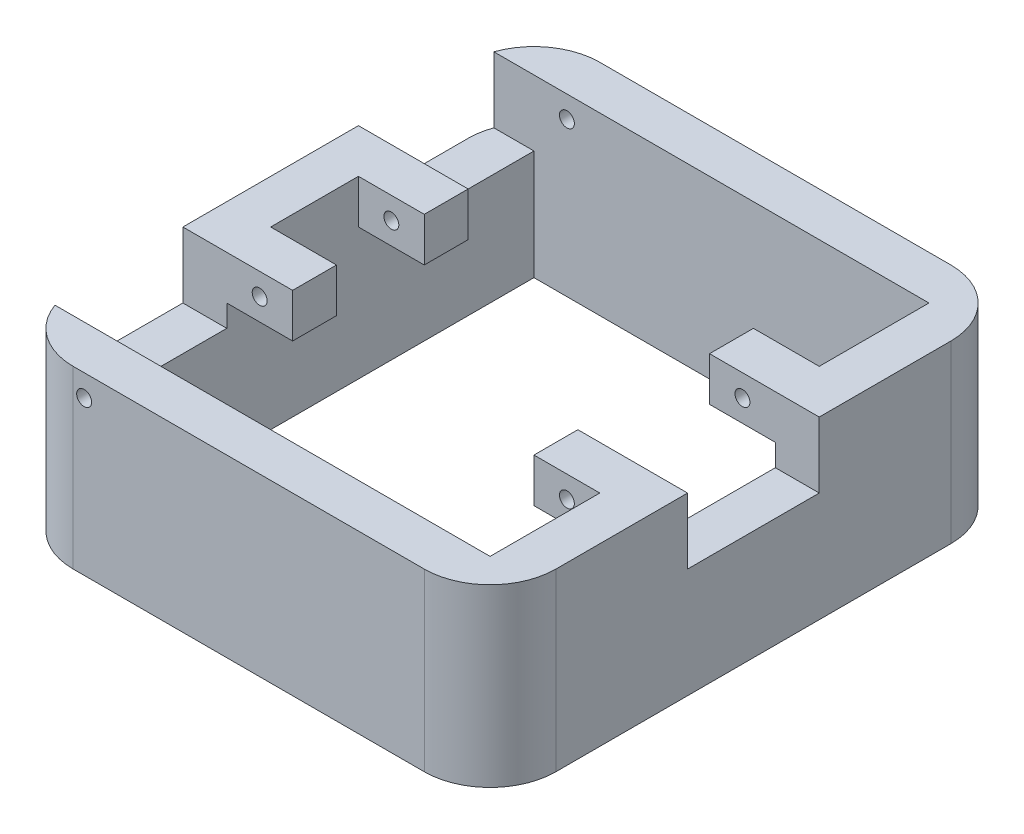
from build123d import *

# Parameters (mm, degrees)
SKETCH1_W               = 90
SKETCH1_H               = 100
BOSS_EXTRUDE1_DEPTH     = 40
SKETCH3_W               = 25
SKETCH3_H               = 40
BOSS_EXTRUDE3_DEPTH     = 10
SKETCH5_W               = 15
SKETCH5_H               = 20
CUT_EXTRUDE1_DEPTH      = 10
SKETCH6_W               = 25
SKETCH6_H               = 10
BOSS_EXTRUDE4_DEPTH     = 10
SKETCH7_W               = 10
SKETCH7_H               = 30
CUT_EXTRUDE2_DEPTH      = 15
CUT_EXTRUDE3_DEPTH      = 108.861822617
CUT_EXTRUDE3_DEPTH_BACK = 108.861822617
SKETCH8_R               = 1.7
SKETCH9_R               = 1.7
CUT_EXTRUDE4_DEPTH      = 57


with BuildPart() as part:
    # Sketch1 → Boss-Extrude1 (new body)
    with BuildSketch(Plane(origin=(0, 0, 0), x_dir=(1, 0, 0), z_dir=(0, 1, 0))):
        with BuildLine():
            Line((-45.284100543, 33.309612736), (34.715899457, 33.309612736))
            ThreePointArc((34.715899457, 33.309612736), (45.322501175, 28.916214454), (49.715899457, 18.309612736))
            Line((49.715899457, 18.309612736), (49.715899457, -71.690387264))
            ThreePointArc((49.715899457, -71.690387264), (45.322501175, -82.296988982), (34.715899457, -86.690387264))
            Line((34.715899457, -86.690387264), (-45.284100543, -86.690387264))
            ThreePointArc((-45.284100543, -86.690387264), (-55.890702261, -82.296988982), (-60.284100543, -71.690387264))
            Line((-60.284100543, -71.690387264), (-60.284100543, 18.309612736))
            ThreePointArc((-60.284100543, 18.309612736), (-55.890702261, 28.916214454), (-45.284100543, 33.309612736))
        make_face()
        with Locations((-5.284100543, -26.690387264)):
            Rectangle(SKETCH1_W, SKETCH1_H, mode=Mode.SUBTRACT)
    extrude(amount=BOSS_EXTRUDE1_DEPTH)

    # Sketch3 → Boss-Extrude3 (add)
    with BuildSketch(Plane(origin=(0, 40, 0), x_dir=(1, 0, 0), z_dir=(0, 1, 0))):
        with Locations((-47.784100543, -26.690387264)):
            Rectangle(SKETCH3_W, SKETCH3_H)
    extrude(amount=-BOSS_EXTRUDE3_DEPTH)

    # Sketch5 → Cut-Extrude1 (cut)
    with BuildSketch(Plane(origin=(0, 40, 0), x_dir=(1, 0, 0), z_dir=(0, 1, 0))):
        with Locations((-42.784100543, -26.690387264)):
            Rectangle(SKETCH5_W, SKETCH5_H)
    extrude(amount=-CUT_EXTRUDE1_DEPTH, mode=Mode.SUBTRACT)

    # Sketch6 → Boss-Extrude4 (add)
    with BuildSketch(Plane(origin=(0, 40, 0), x_dir=(1, 0, 0), z_dir=(0, 1, 0))):
        with Locations((37.215899457, -46.690387264)):
            Rectangle(SKETCH6_W, SKETCH6_H)
        with Locations((37.215899457, -6.690387264)):
            Rectangle(SKETCH6_W, SKETCH6_H)
    extrude(amount=-BOSS_EXTRUDE4_DEPTH)

    # Sketch7 → Cut-Extrude2 (cut)
    with BuildSketch(Plane(origin=(0, 40, 0), x_dir=(1, 0, 0), z_dir=(0, 1, 0))):
        with Locations((-55.284100543, 8.309612736)):
            Rectangle(SKETCH7_W, SKETCH7_H)
        with Locations((-55.284100543, -61.690387264)):
            Rectangle(SKETCH7_W, SKETCH7_H)
        with Locations((44.715899457, -26.690387264)):
            Rectangle(SKETCH7_W, SKETCH7_H)
    extrude(amount=-CUT_EXTRUDE2_DEPTH, mode=Mode.SUBTRACT)

    # Sketch8 → Cut-Extrude3 (cut, two sides: drawn at the far end of the back side and taken through both)
    with BuildSketch(Plane.XY.offset(46.690387264).offset(-CUT_EXTRUDE3_DEPTH_BACK)):
        with Locations((-42.784100543, 35)):
            Circle(SKETCH8_R)
    extrude(amount=CUT_EXTRUDE3_DEPTH + CUT_EXTRUDE3_DEPTH_BACK, mode=Mode.SUBTRACT)

    # Sketch9 → Cut-Extrude4 (cut)
    with BuildSketch(Plane.XY.offset(51.690387264)):
        with Locations((32.215899457, 35)):
            Circle(SKETCH9_R)
    extrude(amount=-CUT_EXTRUDE4_DEPTH, mode=Mode.SUBTRACT)


solid = part.part
